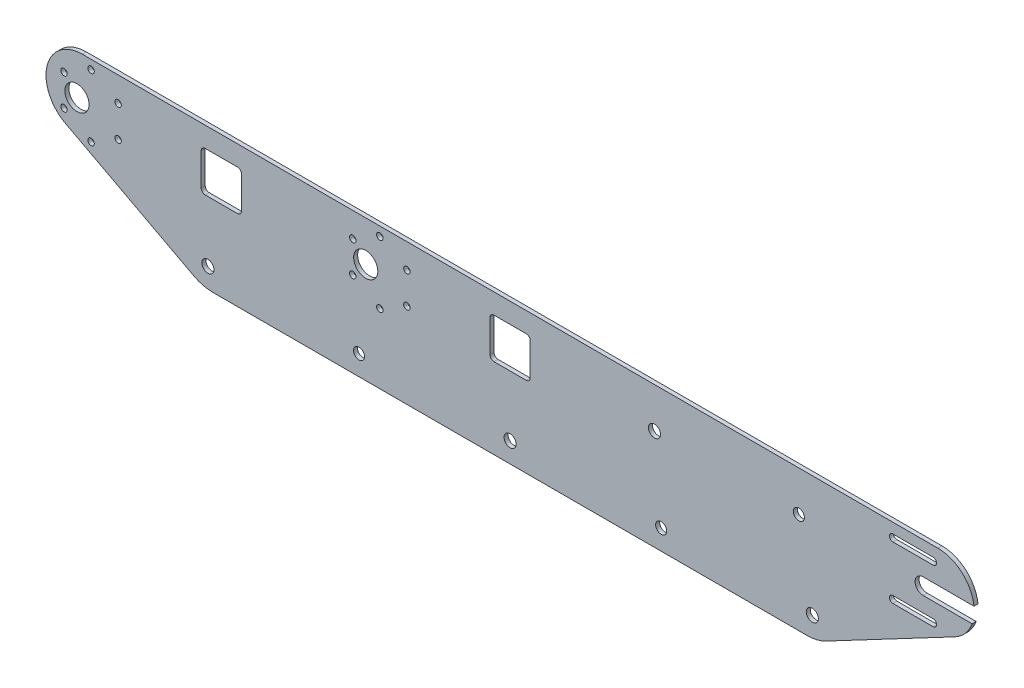
from build123d import *

# Parameters (mm, degrees)
ESQUISSE1_R             = 6
ESQUISSE1_R_2           = 3
BOSS_EXTRU_1_DEPTH      = 2
CONG_1_R                = 18
CONG_2_R                = 20
D_GAGEMENT_M32_D        = 3.4
ENL_V_MAT_EXTRU_1_DEPTH = 234.819122898
ENL_V_MAT_EXTRU_2_DEPTH = 234.819122898
ESQUISSE8_R             = 1.6
ENL_V_MAT_EXTRU_3_DEPTH = 234.819122898
D_GAGEMENT_M51_D        = 5.5
D_GAGEMENT_M52_D        = 5.5
ESQUISSE13_W            = 20
ESQUISSE13_H            = 20
ENL_V_MAT_EXTRU_4_DEPTH = 234.819122898
CONG_3_R                = 2


with BuildPart() as part:
    # Esquisse1 → Boss.-Extru.1 (new body)
    with BuildSketch(Plane.XY):
        Polygon((-284.958991582, 40), (-247.300009613, 40), (248.333273954, 40), (284.958991582, 40), (248.333273954, 20.647569508), (152.479495791, -30), (-152.479495791, -30), (-247.300009613, 20.10160952), align=None)
        with Locations((-215, 20)):
            Circle(ESQUISSE1_R, mode=Mode.SUBTRACT)
        with Locations((-150, -20)):
            Circle(ESQUISSE1_R_2, mode=Mode.SUBTRACT)
        with Locations((150, -20)):
            Circle(ESQUISSE1_R_2, mode=Mode.SUBTRACT)
        with Locations((215, 20)):
            Circle(ESQUISSE1_R_2, mode=Mode.SUBTRACT)
        with Locations((0, -20)):
            Circle(ESQUISSE1_R_2, mode=Mode.SUBTRACT)
        with Locations((-71.666666667, 20)):
            Circle(ESQUISSE1_R, mode=Mode.SUBTRACT)
        with Locations((71.666666667, 20)):
            Circle(ESQUISSE1_R_2, mode=Mode.SUBTRACT)
    extrude(amount=BOSS_EXTRU_1_DEPTH)

    # Congé1
    cong_1_edges = [part.edges().sort_by_distance(p)[0] for p in [
        (-284.958991582, 40, 1),
        (284.958991582, 40, 1),
    ]]
    fillet(cong_1_edges, radius=CONG_1_R)

    # Congé2
    cong_2_edges = [part.edges().sort_by_distance(p)[0] for p in [
        (152.479495791, -30, 1),
        (-152.479495791, -30, 1),
    ]]
    fillet(cong_2_edges, radius=CONG_2_R)

    # Dégagement M32 (through all)
    with Locations(Plane(origin=(0, 0, 0), x_dir=(-1, 0, 0), z_dir=(0, 0, -1))):
        with Locations((-200, 33.228756555), (-200, 6.771243445)):
            Hole(D_GAGEMENT_M32_D / 2)

    # Esquisse4 → Enlèv. mat.-Extru.1 (cut, through all)
    with BuildSketch(Plane(origin=(0, 0, 0), x_dir=(-1, 0, 0), z_dir=(0, 0, -1))):
        with BuildLine():
            Line((-229.334149786, 16), (-205, 16))
            ThreePointArc((-205, 16), (-201, 20), (-205, 24))
            Line((-205, 24), (-230.252130857, 24))
            ThreePointArc((-230.252130857, 24), (-230.246241418, 19.948007721), (-229.334149786, 16))
        make_face()
    extrude(amount=-ENL_V_MAT_EXTRU_1_DEPTH, mode=Mode.SUBTRACT)

    # Esquisse7 → Enlèv. mat.-Extru.2 (cut, through all)
    with BuildSketch(Plane(origin=(0, 0, 0), x_dir=(-1, 0, 0), z_dir=(0, 0, -1))):
        with BuildLine():
            ThreePointArc((-200, 5.071243445), (-201.7, 6.771243445), (-200, 8.471243445))
            Line((-200, 8.471243445), (-210, 8.471243445))
            ThreePointArc((-210, 8.471243445), (-211.7, 6.771243445), (-210, 5.071243445))
            Line((-210, 5.071243445), (-200, 5.071243445))
        make_face()
        with BuildLine():
            Line((-190, 8.471243445), (-200, 8.471243445))
            ThreePointArc((-200, 8.471243445), (-198.797918472, 7.973324973), (-198.3, 6.771243445))
            ThreePointArc((-198.3, 6.771243445), (-198.797918472, 5.569161917), (-200, 5.071243445))
            Line((-200, 5.071243445), (-190, 5.071243445))
            ThreePointArc((-190, 5.071243445), (-188.3, 6.771243445), (-190, 8.471243445))
        make_face()
        with BuildLine():
            Line((-190, 34.928756555), (-200, 34.928756555))
            ThreePointArc((-200, 34.928756555), (-198.797918472, 34.430838083), (-198.3, 33.228756555))
            ThreePointArc((-198.3, 33.228756555), (-198.797918472, 32.026675027), (-200, 31.528756555))
            Line((-200, 31.528756555), (-190, 31.528756555))
            ThreePointArc((-190, 31.528756555), (-188.3, 33.228756555), (-190, 34.928756555))
        make_face()
        with BuildLine():
            ThreePointArc((-200, 31.528756555), (-201.7, 33.228756555), (-200, 34.928756555))
            Line((-200, 34.928756555), (-210, 34.928756555))
            ThreePointArc((-210, 34.928756555), (-211.7, 33.228756555), (-210, 31.528756555))
            Line((-210, 31.528756555), (-200, 31.528756555))
        make_face()
    extrude(amount=-ENL_V_MAT_EXTRU_2_DEPTH, mode=Mode.SUBTRACT)

    # Esquisse8 → Enlèv. mat.-Extru.3 (cut, through all)
    with BuildSketch(Plane(origin=(0, 0, 0), x_dir=(-1, 0, 0), z_dir=(0, 0, -1))):
        with Locations((221.423393759, 27.75)):
            Circle(ESQUISSE8_R)
        with Locations((208, 35.5)):
            Circle(ESQUISSE8_R)
        with Locations((194.576606241, 27.75)):
            Circle(ESQUISSE8_R)
        with Locations((194.576606241, 12.25)):
            Circle(ESQUISSE8_R)
        with Locations((208, 4.5)):
            Circle(ESQUISSE8_R)
        with Locations((221.423393759, 12.25)):
            Circle(ESQUISSE8_R)
        with Locations((78.090060425, 27.75)):
            Circle(ESQUISSE8_R)
        with Locations((64.666666667, 35.5)):
            Circle(ESQUISSE8_R)
        with Locations((51.243272908, 27.75)):
            Circle(ESQUISSE8_R)
        with Locations((51.243272908, 12.25)):
            Circle(ESQUISSE8_R)
        with Locations((64.666666667, 4.5)):
            Circle(ESQUISSE8_R)
        with Locations((78.090060425, 12.25)):
            Circle(ESQUISSE8_R)
    extrude(amount=-ENL_V_MAT_EXTRU_3_DEPTH, mode=Mode.SUBTRACT)

    # Dégagement M51 (through all)
    with Locations(Plane(origin=(0, 0, 0), x_dir=(-1, 0, 0), z_dir=(0, 0, -1))):
        with Locations((143.333333333, 20), (0, 20), (-143.333333333, 20)):
            Hole(D_GAGEMENT_M51_D / 2)

    # Dégagement M52 (through all)
    with Locations(Plane.XY.offset(2)):
        with Locations((-75, -20), (75, -20)):
            Hole(D_GAGEMENT_M52_D / 2)

    # Esquisse13 → Enlèv. mat.-Extru.4 (cut, through all)
    with BuildSketch(Plane.XY.offset(2)):
        with Locations((-143.333333333, 20)):
            Rectangle(ESQUISSE13_W, ESQUISSE13_H)
        with Locations((0, 20)):
            Rectangle(ESQUISSE13_W, ESQUISSE13_H)
    extrude(amount=-ENL_V_MAT_EXTRU_4_DEPTH, mode=Mode.SUBTRACT)

    # Congé3
    cong_3_edges = [part.edges().sort_by_distance(p)[0] for p in [
        (-133.333333333, 30, 1),
        (-133.333333333, 10, 1),
        (-153.333333333, 10, 1),
        (-153.333333333, 30, 1),
        (10, 30, 1),
        (10, 10, 1),
        (-10, 10, 1),
        (-10, 30, 1),
    ]]
    fillet(cong_3_edges, radius=CONG_3_R)


solid = part.part
